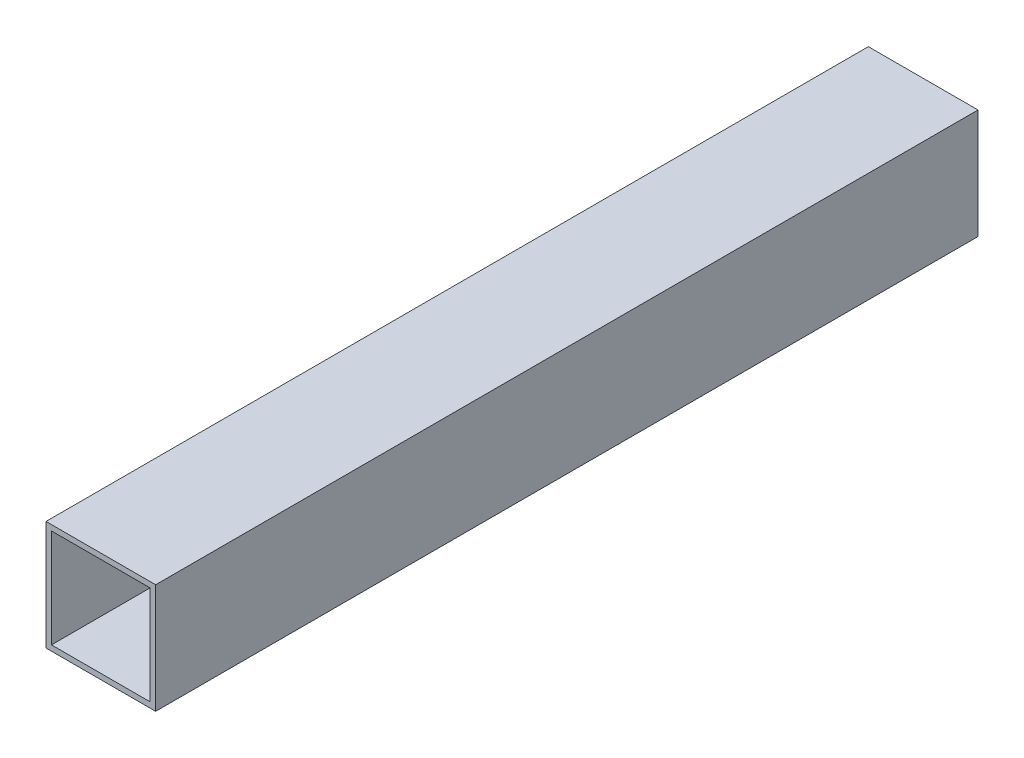
from build123d import *

# Parameters (mm, degrees)
SKETCH_1_W      = 20
SKETCH_1_H      = 20
SKETCH_1_W_2    = 18
SKETCH_1_H_2    = 18
EXTRUDE_1_DEPTH = 150


with BuildPart() as part:
    # 草图1 → 凸台-拉伸1 (new body)
    with BuildSketch(Plane.XY):
        Rectangle(SKETCH_1_W, SKETCH_1_H)
        Rectangle(SKETCH_1_W_2, SKETCH_1_H_2, mode=Mode.SUBTRACT)
    extrude(amount=EXTRUDE_1_DEPTH)


solid = part.part
